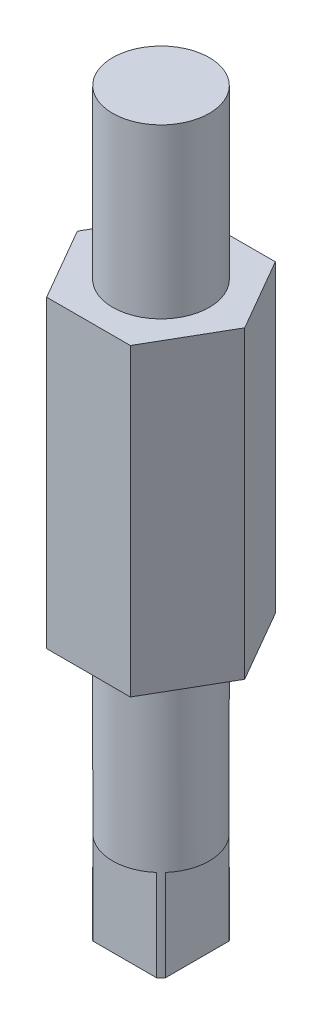
from build123d import *

# Parameters (mm, degrees)
BOSS_EXTRUDE1_DEPTH = 97.0775
SKETCH2_R           = 6.35
CUT_EXTRUDE1_DEPTH  = 22.08
CUT_EXTRUDE2_START  = -35
SKETCH3_R           = 6.35
CUT_EXTRUDE2_DEPTH  = 35
SKETCH4_W           = 9.525
SKETCH4_H           = 9.525
CUT_EXTRUDE3_DEPTH  = 12


with BuildPart() as part:
    # Sketch1 → Boss-Extrude1 (new body)
    with BuildSketch(Plane(origin=(0, 0, 0), x_dir=(1, 0, 0), z_dir=(0, 1, 0))):
        Polygon((5.499261314, 9.525), (-5.499261314, 9.525), (-10.998522628, 0), (-5.499261314, -9.525), (5.499261314, -9.525), (10.998522628, 0), align=None)
    extrude(amount=BOSS_EXTRUDE1_DEPTH)

    # Sketch2 → Cut-Extrude1 (cut)
    with BuildSketch(Plane(origin=(0, 97.0775, 0), x_dir=(1, 0, 0), z_dir=(0, 1, 0))):
        Polygon((10.998522628, 0), (5.499261314, 9.525), (-5.499261314, 9.525), (-10.998522628, 0), (-5.499261314, -9.525), (5.499261314, -9.525), align=None)
        with Locations(Location((0, 0, 0), (0, 0, 270))):
            Circle(SKETCH2_R, mode=Mode.SUBTRACT)
    extrude(amount=-CUT_EXTRUDE1_DEPTH, mode=Mode.SUBTRACT)

    # Sketch3 → Cut-Extrude2 (cut)
    with BuildSketch(Plane.XZ.offset(CUT_EXTRUDE2_START)):
        Polygon((5.499261314, -9.525), (10.998522628, 0), (5.499261314, 9.525), (-5.499261314, 9.525), (-10.998522628, 0), (-5.499261314, -9.525), align=None)
        with Locations(Location((0, 0, 0), (0, 0, 90))):
            Circle(SKETCH3_R, mode=Mode.SUBTRACT)
    extrude(amount=CUT_EXTRUDE2_DEPTH, mode=Mode.SUBTRACT)

    # Sketch4 → Cut-Extrude3 (cut)
    with BuildSketch(Plane.XZ):
        Polygon((-5.499261314, -9.525), (5.499261314, -9.525), (10.998522628, 0), (5.499261314, 9.525), (-5.499261314, 9.525), (-10.998522628, 0), align=None)
        Rectangle(SKETCH4_W, SKETCH4_H, mode=Mode.SUBTRACT)
    extrude(amount=-CUT_EXTRUDE3_DEPTH, mode=Mode.SUBTRACT)


solid = part.part
